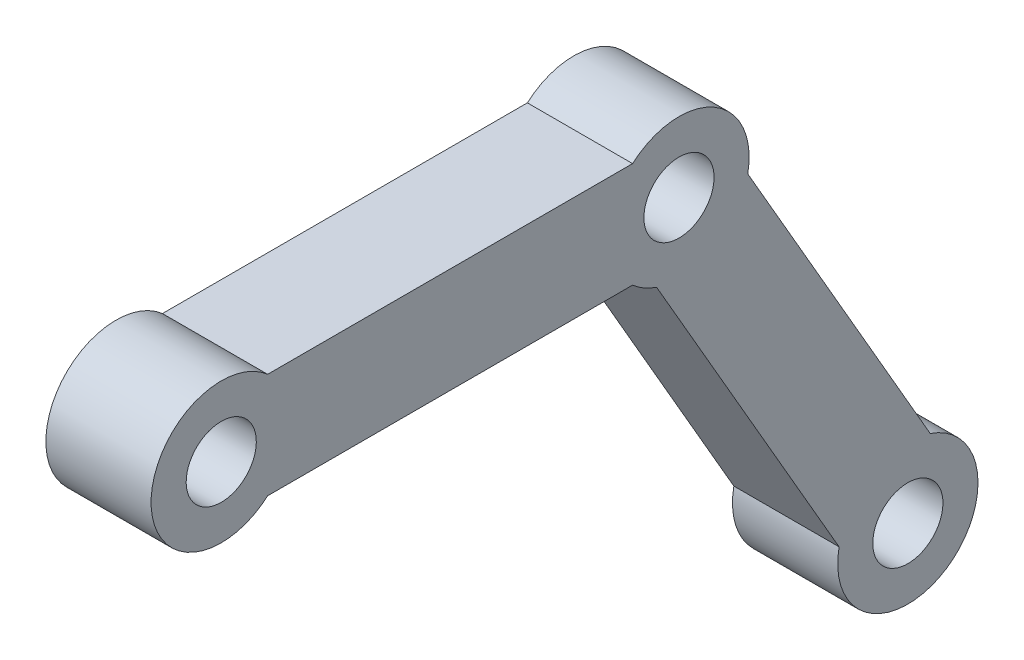
from build123d import *

# Parameters (mm, degrees)
SKETCH2_W           = 30
SKETCH2_H           = 30
SKETCH2_W_2         = 25
SKETCH2_H_2         = 25
SKETCH3_R           = 20
BOSS_EXTRUDE2_DEPTH = 30
SKETCH4_R           = 10
CUT_EXTRUDE1_DEPTH  = 30


with BuildPart() as part:
    # Sweep1: sweep along a path in Sketch1
    with BuildLine(Plane(origin=(0, 0, 0), x_dir=(0, 0, -1), z_dir=(1, 0, 0))) as sweep1_path:
        Line((-130.5, 0), (0, 0))
        Line((0, 0), (65.25, -113.016315194))
    # Sketch2 → Sweep1 (sweep)
    with BuildSketch(Plane.XY.offset(130.5)):
        Rectangle(SKETCH2_W, SKETCH2_H)
        Rectangle(SKETCH2_W_2, SKETCH2_H_2, mode=Mode.SUBTRACT)
    sweep(path=sweep1_path.line, transition=Transition.RIGHT)

    # Sketch3 → Boss-Extrude2 (add)
    with BuildSketch(Plane(origin=(15, 0, 0), x_dir=(0, 0, -1), z_dir=(1, 0, 0))):
        Circle(SKETCH3_R)
        with Locations((65.25, -113.016315194)):
            Circle(SKETCH3_R)
        with Locations((-130.5, 0)):
            Circle(SKETCH3_R)
    extrude(amount=-BOSS_EXTRUDE2_DEPTH)

    # Sketch4 → Cut-Extrude1 (cut)
    with BuildSketch(Plane(origin=(15, 0, 0), x_dir=(0, 0, -1), z_dir=(1, 0, 0))):
        with Locations(Location((-130.5, 0, 0), (0, 0, 90))):
            Circle(SKETCH4_R)
        with Locations(Location((0, 0, 0), (0, 0, 90))):
            Circle(SKETCH4_R)
        with Locations(Location((65.25, -113.016315194, 0), (0, 0, 90))):
            Circle(SKETCH4_R)
    extrude(amount=-CUT_EXTRUDE1_DEPTH, mode=Mode.SUBTRACT)


solid = part.part
